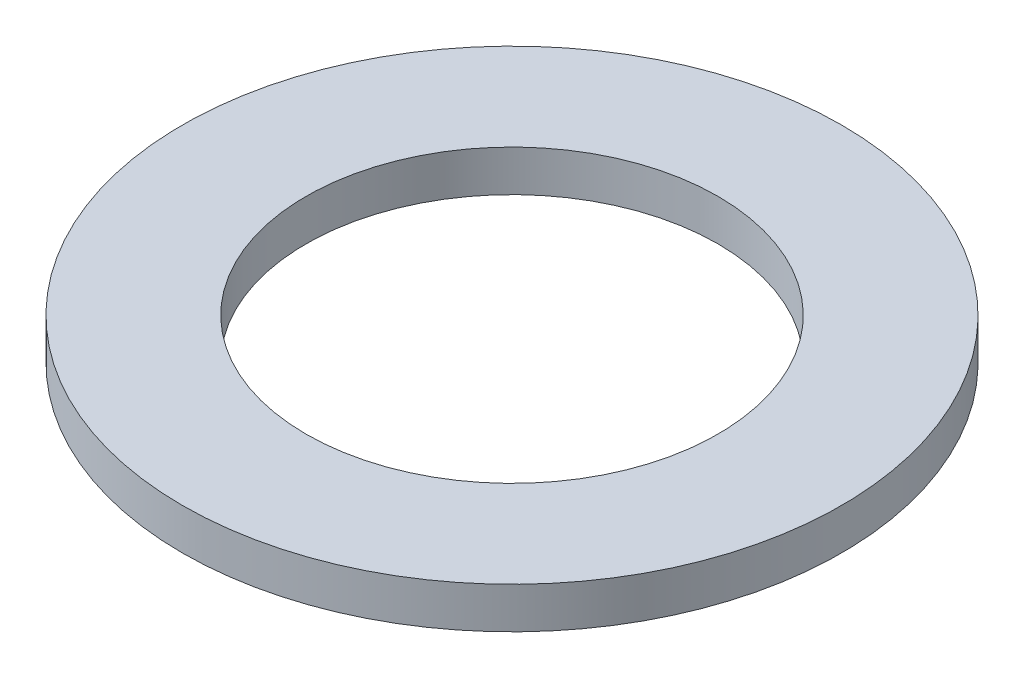
from build123d import *

# Parameters (mm, degrees)
SKETCH_1_R      = 8
SKETCH_1_R_2    = 5
EXTRUDE_1_DEPTH = 1


with BuildPart() as part:
    # 草图1 → 凸台-拉伸1 (new body)
    with BuildSketch(Plane(origin=(0, 0, 0), x_dir=(1, 0, 0), z_dir=(0, 1, 0))):
        with Locations(Location((0, 0, 0), (0, 0, 270))):
            Circle(SKETCH_1_R)
        with Locations(Location((0, 0, 0), (0, 0, 270))):
            Circle(SKETCH_1_R_2, mode=Mode.SUBTRACT)
    extrude(amount=EXTRUDE_1_DEPTH)


solid = part.part
